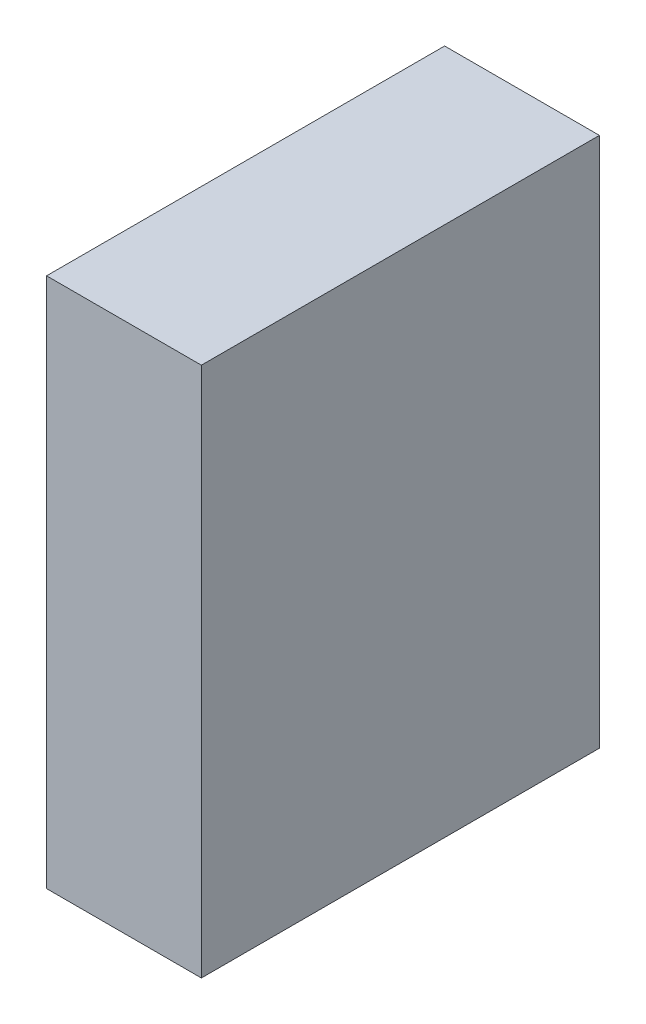
from build123d import *

# Parameters (mm, degrees)
SKETCH_1_W          = 35
SKETCH_1_H          = 120
EXTRUDE_1_DEPTH     = 90
SKETCH_2_R          = 2.1
CUT_EXTRUDE_1_DEPTH = 5


with BuildPart() as part:
    # 草图1 → 凸台-拉伸1 (new body)
    with BuildSketch(Plane.XY):
        with Locations((-8.852941176, -2.147058824)):
            Rectangle(SKETCH_1_W, SKETCH_1_H)
    extrude(amount=EXTRUDE_1_DEPTH)

    # 草图2 → 切除-拉伸1 (cut)
    with BuildSketch(Plane(origin=(0, 0, 0), x_dir=(-1, 0, 0), z_dir=(0, 0, -1))):
        with Locations((8.852941176, 52.852941176)):
            Circle(SKETCH_2_R)
        with Locations((8.852941176, -55.147058824)):
            Circle(SKETCH_2_R)
    extrude(amount=-CUT_EXTRUDE_1_DEPTH, mode=Mode.SUBTRACT)


solid = part.part
